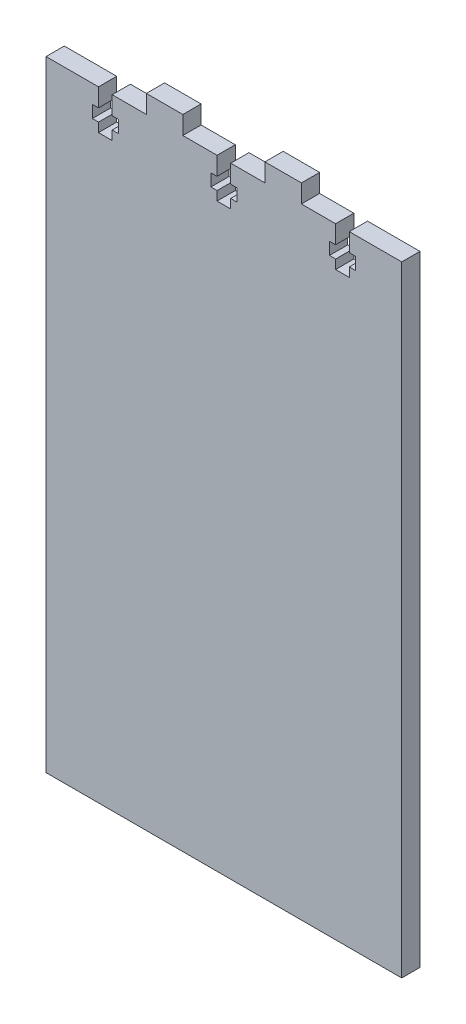
from build123d import *

# Parameters (mm, degrees)
EXTRUDE_1_DEPTH = 4


with BuildPart() as part:
    # 草图1 → 凸台-拉伸1 (new body)
    with BuildSketch(Plane.XY):
        Polygon((-39, 90), (-39, -46), (39, -46), (39, 90), (27.5, 90), (27.5, 86), (28.85, 86), (28.85, 83.3), (27.5, 83.3), (27.5, 81.3), (24.5, 81.3), (24.5, 83.3), (23.15, 83.3), (23.15, 86), (24.5, 86), (24.5, 90), (17, 90), (17, 94), (9, 94), (9, 90), (1.5, 90), (1.5, 86), (2.85, 86), (2.85, 83.3), (1.5, 83.3), (1.5, 81.3), (-1.5, 81.3), (-1.5, 83.3), (-2.85, 83.3), (-2.85, 86), (-1.5, 86), (-1.5, 90), (-9, 90), (-9, 94), (-17, 94), (-17, 90), (-24.5, 90), (-24.5, 86), (-23.15, 86), (-23.15, 83.3), (-24.5, 83.3), (-24.5, 81.3), (-27.5, 81.3), (-27.5, 83.3), (-28.85, 83.3), (-28.85, 86), (-27.5, 86), (-27.5, 90), align=None)
    extrude(amount=EXTRUDE_1_DEPTH)


solid = part.part
